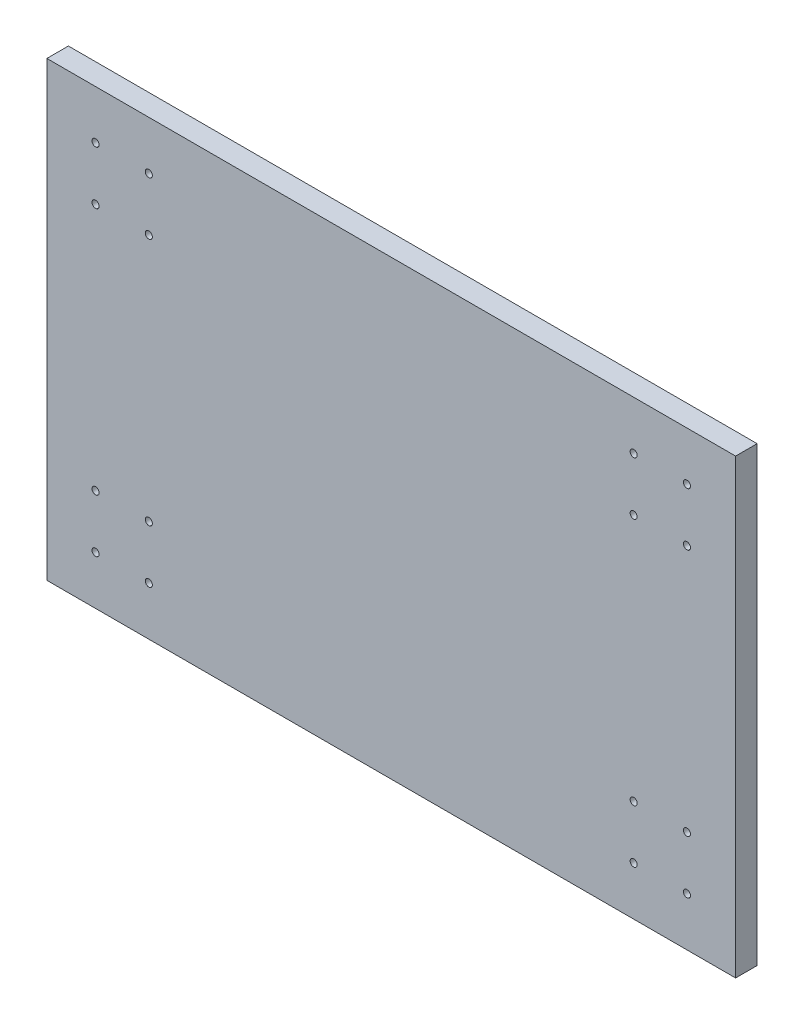
from build123d import *

# Parameters (mm, degrees)
SKETCH_1_W                  = 320
SKETCH_1_H                  = 210
EXTRUDE_1_DEPTH             = 10
HOLE_WIZARD_M41_D           = 3.3
HOLE_WIZARD_M41_DEPTH       = 11.5
HOLE_WIZARD_M41_CSINK_D     = 4.05
HOLE_WIZARD_M41_CSINK_ANGLE = 120
HOLE_WIZARD_M41_TIP         = 0.991420021


with BuildPart() as part:
    # Эскиз1 → Бобышка-Вытянуть1 (new body)
    with BuildSketch(Plane.XY):
        with Locations((160, 105)):
            Rectangle(SKETCH_1_W, SKETCH_1_H)
    extrude(amount=EXTRUDE_1_DEPTH)

    # Отверстие обработанное метчиком M41
    with Locations(Plane(origin=(0, 0, 0), x_dir=(-1, 0, 0), z_dir=(0, 0, -1))):
        with Locations((-22.625631329, 22.625631329), (-47.374368671, 22.625631329), (-47.374368671, 47.374368671), (-22.625631329, 47.374368671), (-297.374368671, 47.374368671), (-272.625631329, 47.374368671), (-272.625631329, 22.625631329), (-297.374368671, 22.625631329), (-22.625631329, 162.625631329), (-47.374368671, 162.625631329), (-47.374368671, 187.374368671), (-22.625631329, 187.374368671), (-297.374368671, 187.374368671), (-272.625631329, 187.374368671), (-272.625631329, 162.625631329), (-297.374368671, 162.625631329)):
            CounterSinkHole(HOLE_WIZARD_M41_D / 2, HOLE_WIZARD_M41_CSINK_D / 2, depth=HOLE_WIZARD_M41_DEPTH, counter_sink_angle=HOLE_WIZARD_M41_CSINK_ANGLE)
            with Locations((0, 0, -(HOLE_WIZARD_M41_DEPTH + HOLE_WIZARD_M41_TIP / 2))):  # 118° drill point
                Cone(0, HOLE_WIZARD_M41_D / 2, HOLE_WIZARD_M41_TIP, mode=Mode.SUBTRACT)


solid = part.part
